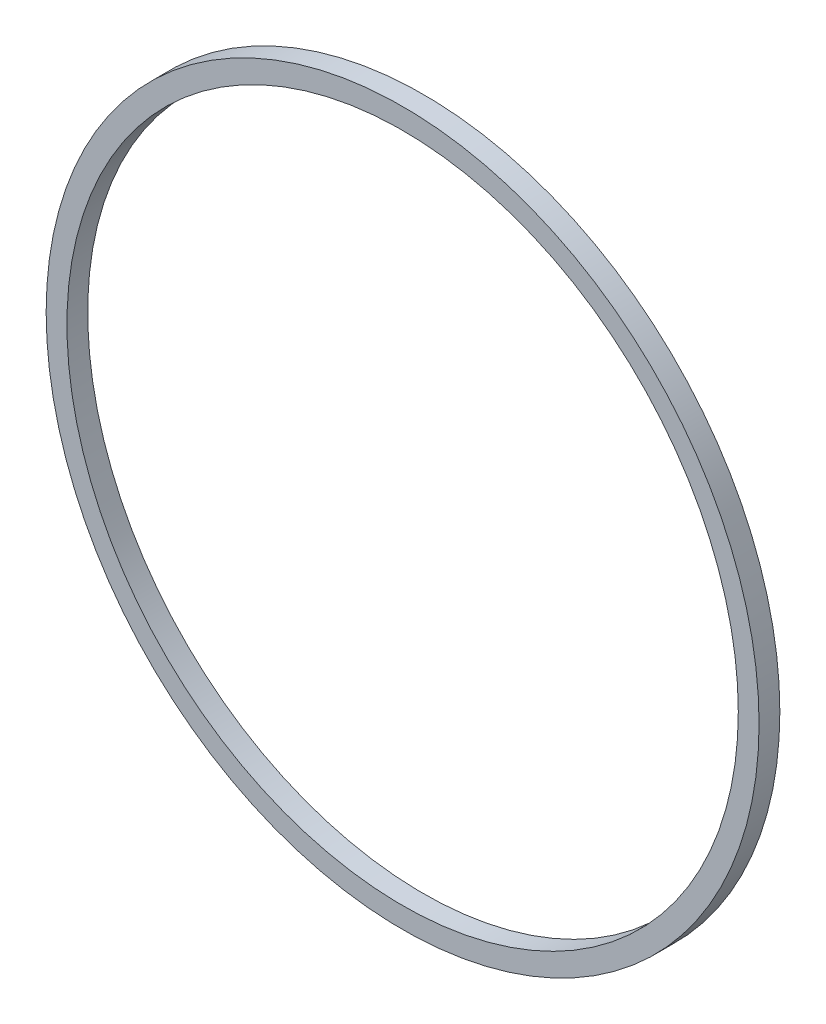
from build123d import *

# Parameters (mm, degrees)
SKETCH1_R           = 30.5054
SKETCH1_R_2         = 28.7274
BOSS_EXTRUDE1_DEPTH = 1.778


with BuildPart() as part:
    # Sketch1 → Boss-Extrude1 (new body)
    with BuildSketch(Plane.XY):
        Circle(SKETCH1_R)
        Circle(SKETCH1_R_2, mode=Mode.SUBTRACT)
    extrude(amount=BOSS_EXTRUDE1_DEPTH)


solid = part.part
